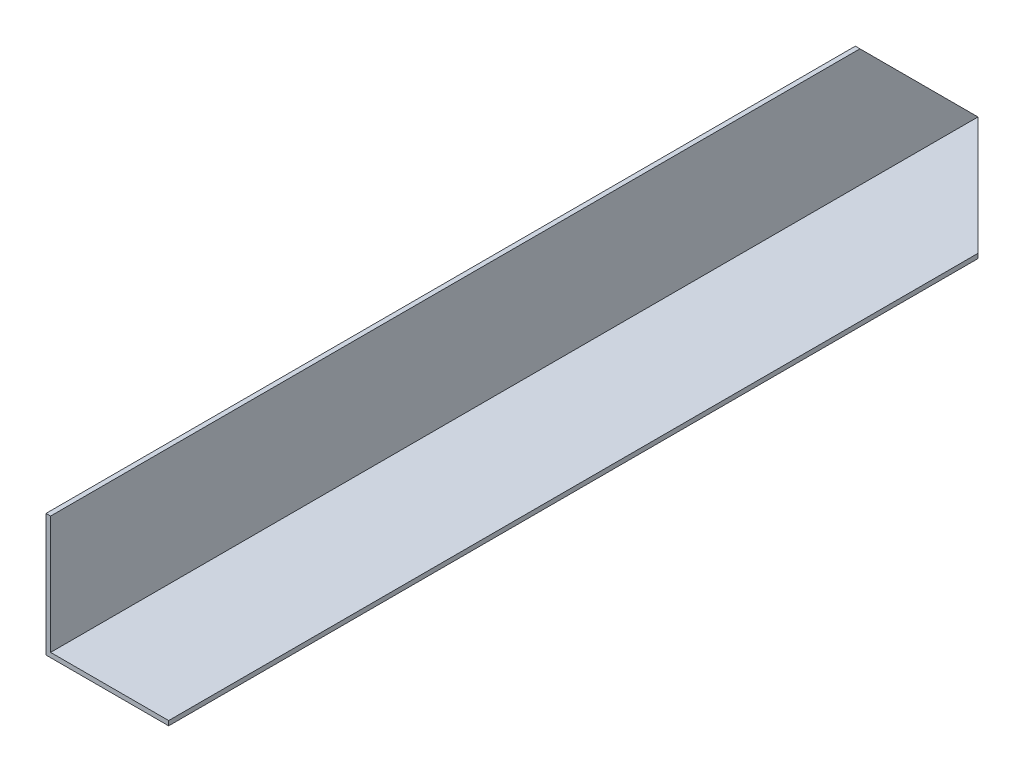
from build123d import *

# Parameters (mm, degrees)
AUFSATZ_LINEAR_AUSTRAGEN1_DEPTH = 303.9
SCHNITT_LINEAR_AUSTRAGEN1_DEPTH = 1.5
SCHNITT_LINEAR_AUSTRAGEN2_DEPTH = 1.5


with BuildPart() as part:
    # Skizze1 → Aufsatz-Linear austragen1 (new body)
    with BuildSketch(Plane(origin=(0, 0, 300), x_dir=(-1, 0, 0), z_dir=(0, 0, -1))):
        Polygon((461.5, -500), (500, -500), (500, -461.5), (501.5, -461.5), (501.5, -501.5), (461.5, -501.5), align=None)
    extrude(amount=AUFSATZ_LINEAR_AUSTRAGEN1_DEPTH)

    # Skizze2 → Schnitt-Linear austragen1 (cut)
    with BuildSketch(Plane.XZ.offset(501.5)):
        Polygon((-461.5, -3.9), (-501.5, -3.9), (-461.5, 36.1), align=None)
    extrude(amount=-SCHNITT_LINEAR_AUSTRAGEN1_DEPTH, mode=Mode.SUBTRACT)

    # Skizze3 → Schnitt-Linear austragen2 (cut)
    with BuildSketch(Plane.ZY.offset(501.5)):
        Polygon((-3.9, -461.5), (-3.9, -501.5), (36.1, -461.5), align=None)
    extrude(amount=-SCHNITT_LINEAR_AUSTRAGEN2_DEPTH, mode=Mode.SUBTRACT)


solid = part.part
